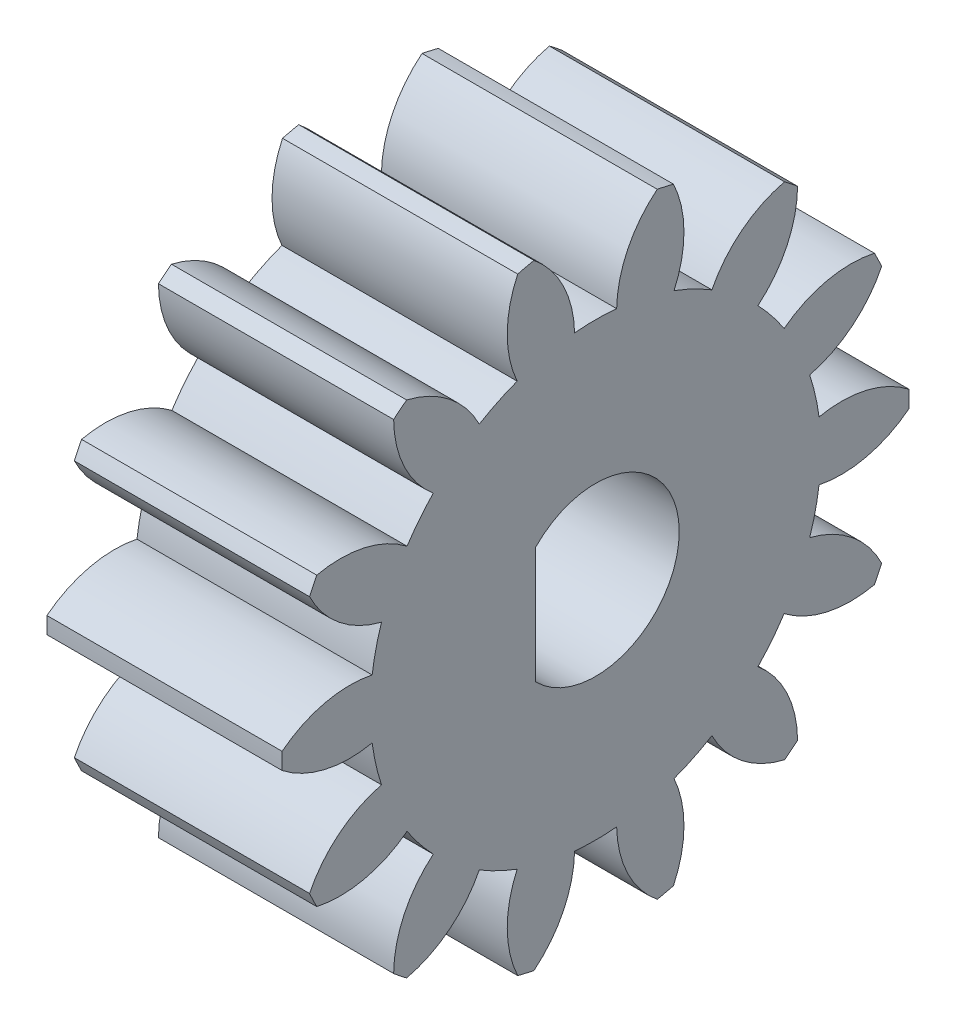
from build123d import *

# Parameters (mm, degrees)
BASPROSKE_W         = 14
BASPROSKE_H         = 12
TOOTHCUT_DEPTH      = 23
TEETHCUTS_COUNT     = 14
TEETHCUTS_ANGLE     = 334.285714286
BORSKE_R            = 3
BORE_DEPTH          = 50.0000508
SKETCH2_R           = 16.086266861
CUT_EXTRUDE1_DEPTH  = 5
SKETCH3_R           = 3.2
CUT_EXTRUDE2_DEPTH  = 20.064015522
BOSS_EXTRUDE1_DEPTH = 9


with BuildPart() as part:
    # BasProSke → Base-Revolve (revolve)
    with BuildSketch(Plane(origin=(0, 0, 0), x_dir=(1, 0, 0), z_dir=(0, 1, 0)), mode=Mode.PRIVATE) as base_revolve_sk:
        with Locations((7, 6)):
            Rectangle(BASPROSKE_W, BASPROSKE_H)
    revolve(base_revolve_sk.sketch.rotate(Axis((-10, 0, 0), (1, 0, 0)), 180), axis=Axis((-10, 0, 0), (1, 0, 0)))

    # TooCutSke → ToothCut (cut, through all)
    with BuildSketch(Plane(origin=(0, 0, 0), x_dir=(0, 0, -1), z_dir=(1, 0, 0))):
        with BuildLine():
            ThreePointArc((0.804845511, 8.586361261), (0, 8.624), (-0.804845511, 8.586361261))
            ThreePointArc((-0.804845511, 8.586361261), (-1.237812142, 10.362618414), (-2.384428228, 11.78663426))
            ThreePointArc((-2.384428228, 11.78663426), (0, 12.0254), (2.384428228, 11.78663426))
            ThreePointArc((2.384428228, 11.78663426), (1.237812142, 10.362618414), (0.804845511, 8.586361261))
        make_face()
    toothcut = extrude(amount=TOOTHCUT_DEPTH, mode=Mode.SUBTRACT)

    # TeethCuts: ToothCut ×14 about axis
    teethcuts_axis = Axis((-10, 0, 0), (1, 0, 0))
    for i in range(1, TEETHCUTS_COUNT):
        add(toothcut.rotate(teethcuts_axis, i * TEETHCUTS_ANGLE / (TEETHCUTS_COUNT - 1)), mode=Mode.SUBTRACT)

    # BorSke → Bore (cut, symmetric)
    with BuildSketch(Plane(origin=(0, 0, 0), x_dir=(0, 0, -1), z_dir=(1, 0, 0))):
        with Locations(Location((0, 0, 0), (0, 0, 180))):
            Circle(BORSKE_R)
    extrude(amount=BORE_DEPTH, both=True, mode=Mode.SUBTRACT)

    # Sketch2 → Cut-Extrude1 (cut)
    with BuildSketch(Plane(origin=(14, 0, 0), x_dir=(0, 0, -1), z_dir=(1, 0, 0))):
        Circle(SKETCH2_R)
    extrude(amount=-CUT_EXTRUDE1_DEPTH, mode=Mode.SUBTRACT)

    # Sketch3 → Cut-Extrude2 (cut, through all)
    with BuildSketch(Plane(origin=(9, 0, 0), x_dir=(0, 0, -1), z_dir=(1, 0, 0))):
        Circle(SKETCH3_R)
    extrude(amount=-CUT_EXTRUDE2_DEPTH, mode=Mode.SUBTRACT)

    # Sketch4 → Boss-Extrude1 (add)
    with BuildSketch(Plane(origin=(9, 0, 0), x_dir=(0, 0, -1), z_dir=(1, 0, 0))):
        with BuildLine():
            Line((-2.3, 2.224859546), (-2.3, -2.224859546))
            ThreePointArc((-2.3, -2.224859546), (-3.2, 0), (-2.3, 2.224859546))
        make_face()
    extrude(amount=-BOSS_EXTRUDE1_DEPTH)


solid = part.part
